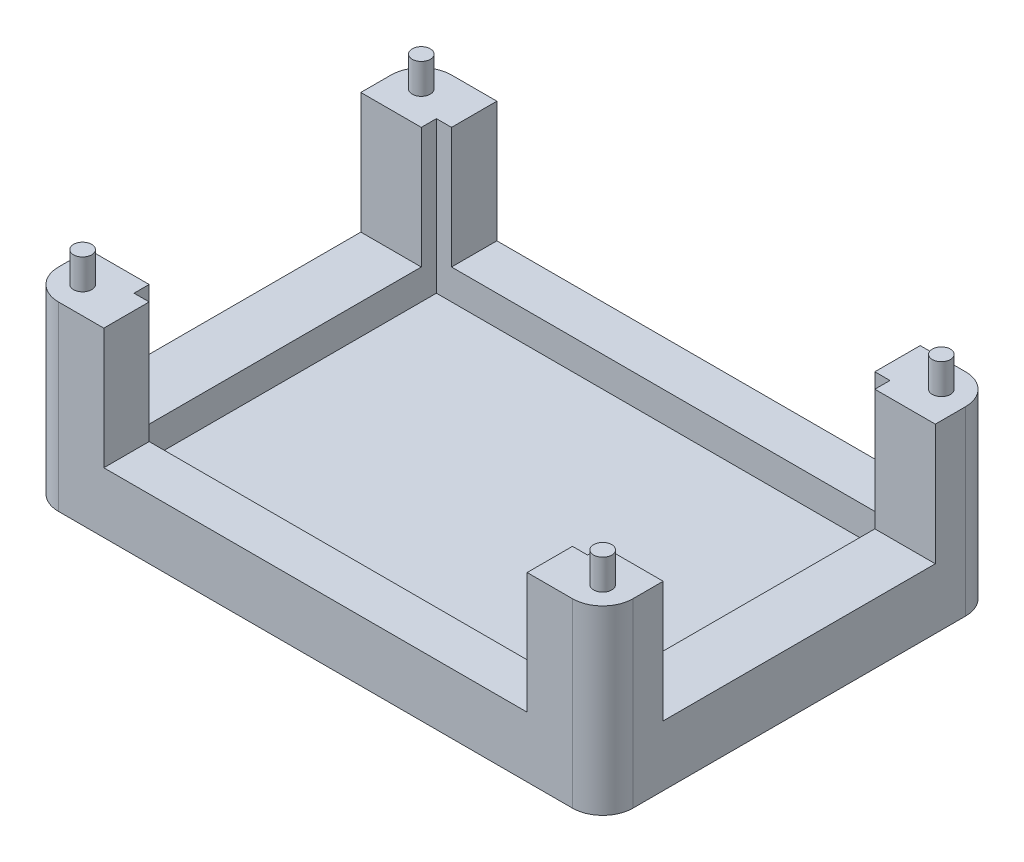
from build123d import *

# Parameters (mm, degrees)
SKETCH1_W           = 95
SKETCH1_H           = 65
BOSS_EXTRUDE1_DEPTH = 30
FILLET1_R           = 5
SKETCH2_W           = 75
SKETCH2_H           = 50
CUT_EXTRUDE1_DEPTH  = 25
SKETCH3_R           = 1.5
BOSS_EXTRUDE2_DEPTH = 5
SKETCH4_W           = 45
SKETCH4_H           = 40
CUT_EXTRUDE2_DEPTH  = 107.330851591
SKETCH5_W           = 70
SKETCH5_H           = 40
CUT_EXTRUDE3_DEPTH  = 88.78524933


with BuildPart() as part:
    # Sketch1 → Boss-Extrude1 (new body)
    with BuildSketch(Plane(origin=(0, 0, 0), x_dir=(1, 0, 0), z_dir=(0, 1, 0))):
        Rectangle(SKETCH1_W, SKETCH1_H)
    extrude(amount=BOSS_EXTRUDE1_DEPTH)

    # Fillet1
    fillet1_edges = [part.edges().sort_by_distance(p)[0] for p in [
        (47.5, 15, 32.5),
        (-47.5, 15, 32.5),
        (-47.5, 15, -32.5),
        (47.5, 15, -32.5),
    ]]
    fillet(fillet1_edges, radius=FILLET1_R)

    # Sketch2 → Cut-Extrude1 (cut)
    with BuildSketch(Plane(origin=(0, 30, 0), x_dir=(1, 0, 0), z_dir=(0, 1, 0))):
        Rectangle(SKETCH2_W, SKETCH2_H)
    extrude(amount=-CUT_EXTRUDE1_DEPTH, mode=Mode.SUBTRACT)

    # Sketch3 → Boss-Extrude2 (add)
    with BuildSketch(Plane(origin=(0, 30, 0), x_dir=(1, 0, 0), z_dir=(0, 1, 0))):
        with Locations(Location((43, 28, 0), (0, 0, 270))):
            Circle(SKETCH3_R)
        with Locations(Location((-43, 28, 0), (0, 0, 270))):
            Circle(SKETCH3_R)
        with Locations(Location((43, -28, 0), (0, 0, 270))):
            Circle(SKETCH3_R)
        with Locations(Location((-43, -28, 0), (0, 0, 270))):
            Circle(SKETCH3_R)
    extrude(amount=BOSS_EXTRUDE2_DEPTH)

    # Sketch4 → Cut-Extrude2 (cut, through all)
    with BuildSketch(Plane(origin=(47.5, 0, 0), x_dir=(0, 0, -1), z_dir=(1, 0, 0))):
        with Locations((0, 30)):
            Rectangle(SKETCH4_W, SKETCH4_H)
    extrude(amount=-CUT_EXTRUDE2_DEPTH, mode=Mode.SUBTRACT)

    # Sketch5 → Cut-Extrude3 (cut, through all)
    with BuildSketch(Plane.XY.offset(32.5)):
        with Locations((0, 30)):
            Rectangle(SKETCH5_W, SKETCH5_H)
    extrude(amount=-CUT_EXTRUDE3_DEPTH, mode=Mode.SUBTRACT)


solid = part.part
